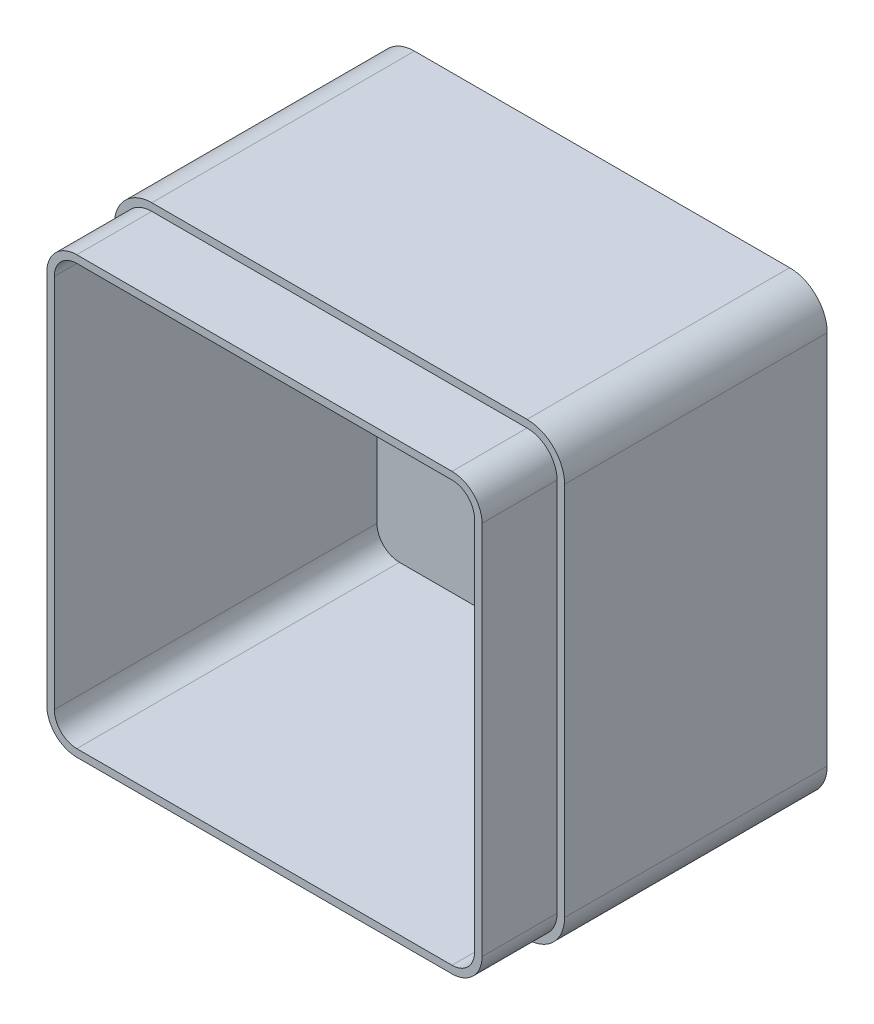
from build123d import *

# Parameters (mm, degrees)
SKETCH1_W           = 120
SKETCH1_H           = 120
BOSS_EXTRUDE1_DEPTH = 90
FILLET1_R           = 10
SHELL1_T            = -4
CUT_EXTRUDE1_DEPTH  = 20


with BuildPart() as part:
    # Sketch1 → Boss-Extrude1 (new body)
    with BuildSketch(Plane.XY):
        Rectangle(SKETCH1_W, SKETCH1_H)
    extrude(amount=BOSS_EXTRUDE1_DEPTH)

    # Fillet1
    fillet1_edges = [part.edges().sort_by_distance(p)[0] for p in [
        (60, -60, 45),
        (-60, -60, 45),
        (-60, 60, 45),
        (60, 60, 45),
    ]]
    fillet(fillet1_edges, radius=FILLET1_R)

    # Shell1
    shell1_openings = [part.faces().sort_by_distance(p)[0] for p in [
        (0, 0, 90),
    ]]
    offset(amount=SHELL1_T, openings=shell1_openings, kind=Kind.INTERSECTION)

    # Sketch2 → Cut-Extrude1 (cut)
    with BuildSketch(Plane.XY.offset(90)):
        with BuildLine():
            Line((-50, -60), (50, -60))
            ThreePointArc((50, -60), (57.071067812, -57.071067812), (60, -50))
            Line((60, -50), (60, 50))
            ThreePointArc((60, 50), (57.071067812, 57.071067812), (50, 60))
            Line((50, 60), (-50, 60))
            ThreePointArc((-50, 60), (-57.071067812, 57.071067812), (-60, 50))
            Line((-60, 50), (-60, -50))
            ThreePointArc((-60, -50), (-57.071067812, -57.071067812), (-50, -60))
        make_face()
        with BuildLine():
            Line((-50, -58), (50, -58))
            ThreePointArc((50, -58), (55.656854249, -55.656854249), (58, -50))
            Line((58, -50), (58, 50))
            ThreePointArc((58, 50), (55.656854249, 55.656854249), (50, 58))
            Line((50, 58), (-50, 58))
            ThreePointArc((-50, 58), (-55.656854249, 55.656854249), (-58, 50))
            Line((-58, 50), (-58, -50))
            ThreePointArc((-58, -50), (-55.656854249, -55.656854249), (-50, -58))
        make_face(mode=Mode.SUBTRACT)
    extrude(amount=-CUT_EXTRUDE1_DEPTH, mode=Mode.SUBTRACT)


solid = part.part
